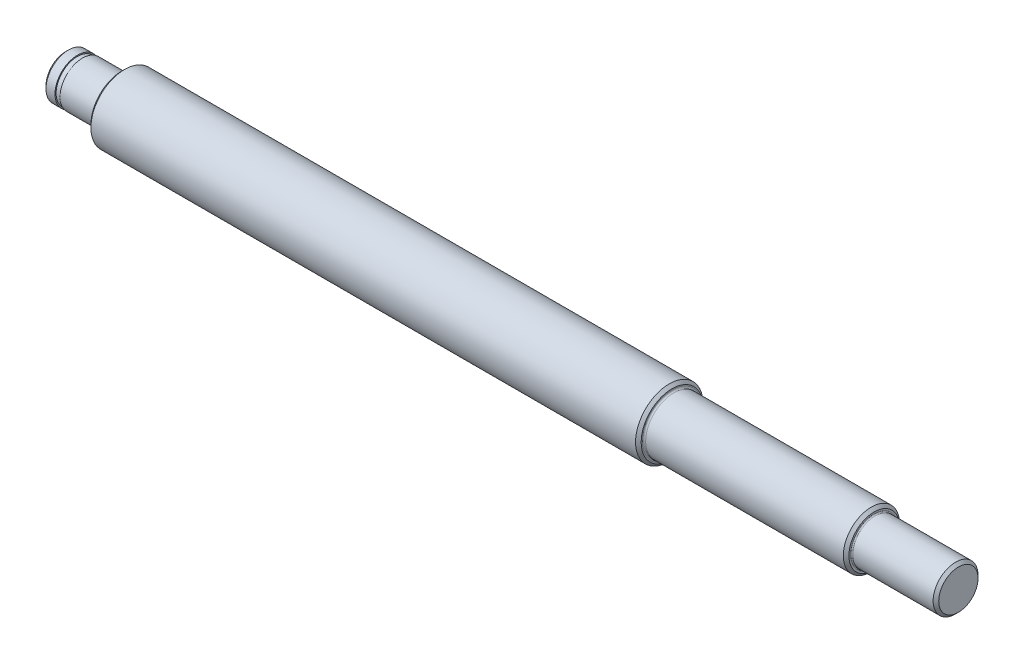
from build123d import *


with BuildPart() as part:
    # Sketch1 → Revolve1 (revolve)
    with BuildSketch(Plane.XY):
        with BuildLine():
            Line((2.1, 4), (2.1, 3.8))
            Line((2.1, 3.8), (3, 3.8))
            Line((3, 3.8), (3, 4))
            Line((3, 4), (9.7, 4))
            ThreePointArc((9.7, 4), (9.912132034, 4.087867966), (10, 4.3))
            Line((10, 4.3), (10, 5.5))
            Line((10, 5.5), (10.5, 6))
            Line((10.5, 6), (107.5, 6))
            Line((107.5, 6), (108, 5.5))
            Line((108, 5.5), (108, 5.3))
            ThreePointArc((108, 5.3), (108.087867966, 5.087867966), (108.3, 5))
            Line((108.3, 5), (143.5, 5))
            Line((143.5, 5), (144, 4.5))
            Line((144, 4.5), (144, 4.2))
            ThreePointArc((144, 4.2), (144.058578644, 4.058578644), (144.2, 4))
            Line((144.2, 4), (158.5, 4))
            Line((158.5, 4), (159, 3.5))
            Line((159, 3.5), (159, 0))
            Line((159, 0), (0, 0))
            Line((0, 0), (0, 3.5))
            Line((0, 3.5), (0.5, 4))
            Line((0.5, 4), (2.1, 4))
        make_face()
    revolve(axis=Axis((-7.5, 0, 0), (1, 0, 0)))


solid = part.part
